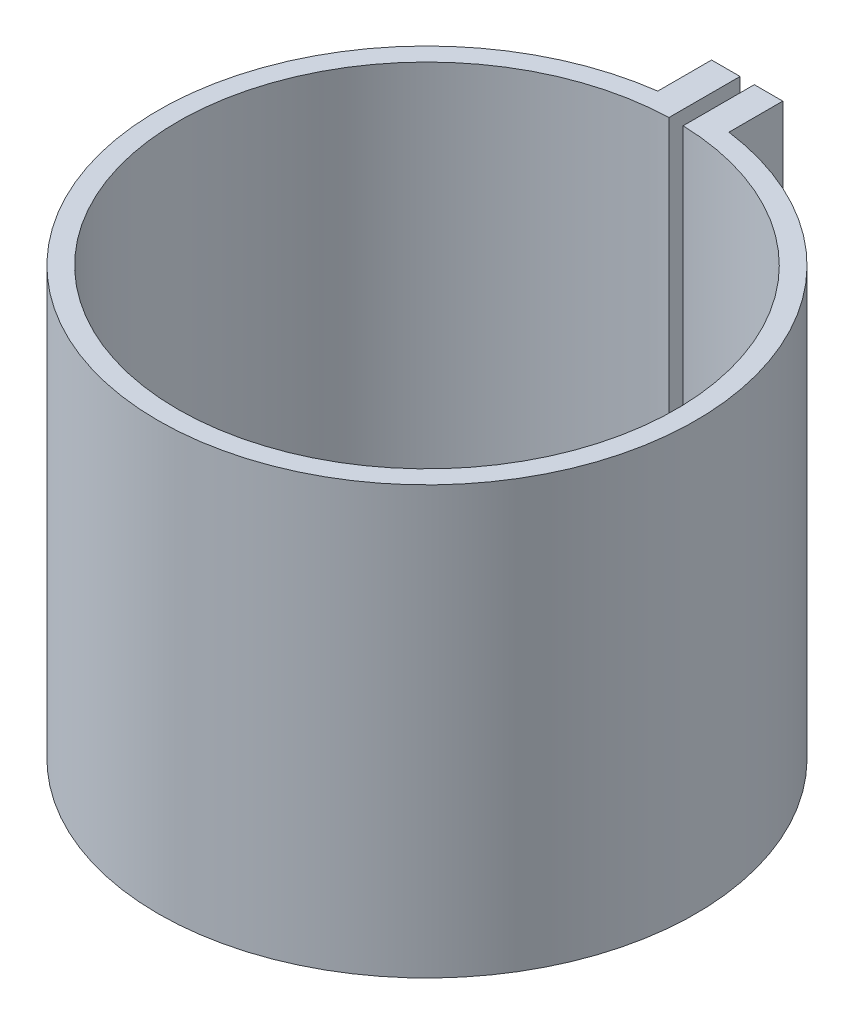
from build123d import *

# Parameters (mm, degrees)
BOSS_EXTRUDE1_DEPTH = 15


with BuildPart() as part:
    # Sketch1 → Boss-Extrude1 (new, symmetric)
    with BuildSketch(Plane(origin=(0, 0, 0), x_dir=(1, 0, 0), z_dir=(0, 1, 0))):
        with BuildLine():
            Line((-2.5, 22.492855685), (-2.5, 18.711987258))
            ThreePointArc((-2.5, 18.711987258), (0, -18.878253816), (2.5, 18.711987258))
            Line((2.5, 18.711987258), (2.5, 22.492855685))
            Line((2.5, 22.492855685), (0.5, 22.492855685))
            Line((0.5, 22.492855685), (0.5, 17.492855685))
            ThreePointArc((0.5, 17.492855685), (0, -17.5), (-0.5, 17.492855685))
            Line((-0.5, 17.492855685), (-0.5, 22.492855685))
            Line((-0.5, 22.492855685), (-2.5, 22.492855685))
        make_face()
    extrude(amount=BOSS_EXTRUDE1_DEPTH, both=True)


solid = part.part
